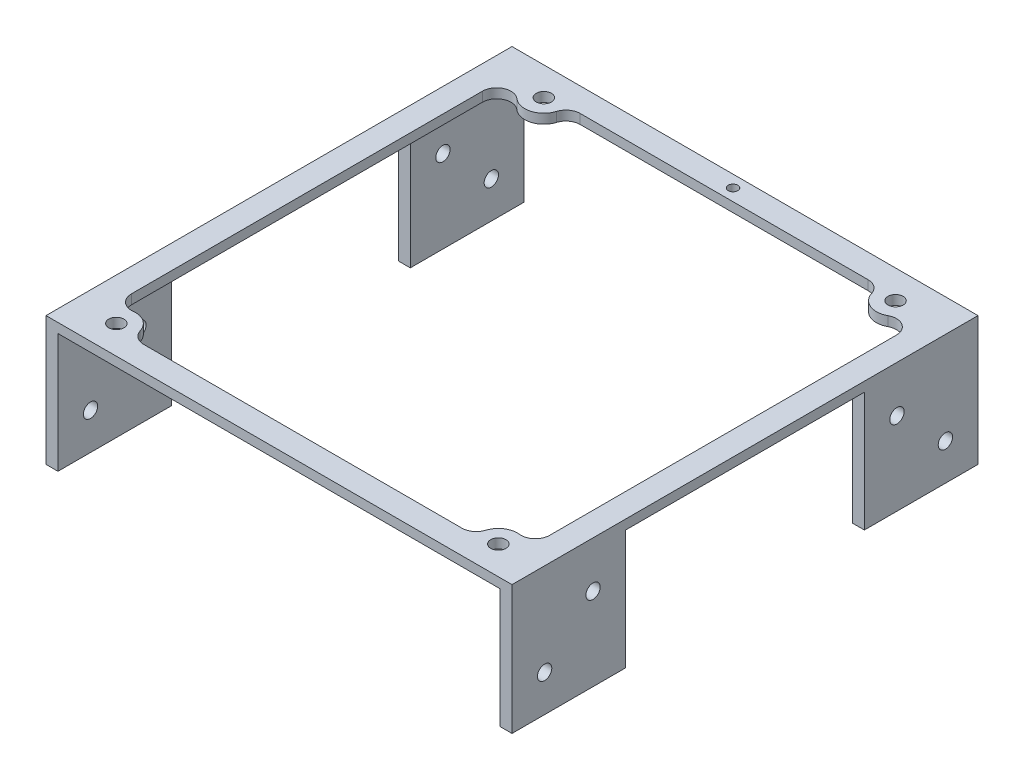
from build123d import *

# Parameters (mm, degrees)
SKETCH_1_W          = 97.6
SKETCH_1_H          = 97.6
SKETCH_1_R          = 1.59
EXTRUDE_1_DEPTH     = 2
SKETCH_2_R          = 1
CUT_EXTRUDE_1_DEPTH = 139.04173282
EXTRUDE_START       = -2
SKETCH_7_W          = 2.5
SKETCH_7_H          = 23.8
EXTRUDE_2_DEPTH     = 25
SKETCH_8_R          = 1.5
CUT_EXTRUDE_2_DEPTH = 141.273019501


with BuildPart() as part:
    # Эскиз1 → Бобышка-Вытянуть1 (new body)
    with BuildSketch(Plane(origin=(0, 0, 0), x_dir=(1, 0, 0), z_dir=(0, 1, 0))):
        with Locations((48.8, 48.8)):
            Rectangle(SKETCH_1_W, SKETCH_1_H)
        with Locations(Location((86.265001451, 91.665000306, 0), (0, 0, 270))):
            Circle(SKETCH_1_R, mode=Mode.SUBTRACT)
        with Locations(Location((88.805001451, 5.935000306, 0), (0, 0, 270))):
            Circle(SKETCH_1_R, mode=Mode.SUBTRACT)
        with Locations(Location((8.795001451, 5.935000306, 0), (0, 0, 270))):
            Circle(SKETCH_1_R, mode=Mode.SUBTRACT)
        with Locations(Location((12.605001451, 91.665000306, 0), (0, 0, 270))):
            Circle(SKETCH_1_R, mode=Mode.SUBTRACT)
        with BuildLine():
            Line((79.576520776, 92.6), (19.293482126, 92.6))
            ThreePointArc((19.293482126, 92.6), (17.512330868, 92.014021582), (16.426990408, 90.485000131))
            ThreePointArc((16.426990408, 90.485000131), (13.697675352, 87.817135476), (9.97357205, 88.652430089))
            ThreePointArc((9.97357205, 88.652430089), (6.759176917, 89.124368033), (5, 86.393002427))
            Line((5, 86.393002427), (5, 12.889708976))
            ThreePointArc((5, 12.889708976), (6.002770009, 10.651166513), (8.340714907, 9.909119546))
            ThreePointArc((8.340714907, 9.909119546), (10.982952752, 9.28356255), (12.616990516, 7.115000131))
            ThreePointArc((12.616990516, 7.115000131), (13.702330946, 5.5859785), (15.483482314, 5))
            Line((15.483482314, 5), (82.116520587, 5))
            ThreePointArc((82.116520587, 5), (83.897671955, 5.5859785), (84.983012386, 7.115000131))
            ThreePointArc((84.983012386, 7.115000131), (86.617049451, 9.283562094), (89.259286336, 9.909119736))
            ThreePointArc((89.259286336, 9.909119736), (91.597230458, 10.651167261), (92.6, 12.889709308))
            Line((92.6, 12.889709308), (92.6, 85.510507258))
            ThreePointArc((92.6, 85.510507258), (91.13495028, 88.088089), (88.170714907, 88.148147136))
            ThreePointArc((88.170714907, 88.148147136), (84.753959284, 87.961386993), (82.443012494, 90.485000131))
            ThreePointArc((82.443012494, 90.485000131), (81.357672034, 92.014021582), (79.576520776, 92.6))
        make_face(mode=Mode.SUBTRACT)
    extrude(amount=EXTRUDE_1_DEPTH)

    # Эскиз2 → Вырез-Вытянуть1 (cut, through all)
    with BuildSketch(Plane(origin=(0, 2, 0), x_dir=(1, 0, 0), z_dir=(0, 1, 0))):
        with Locations(Location((48.8, 95.1, 0), (0, 0, 270))):
            Circle(SKETCH_2_R)
    extrude(amount=-CUT_EXTRUDE_1_DEPTH, mode=Mode.SUBTRACT)

    # Эскиз7 → Бобышка-Вытянуть2 (add)
    with BuildSketch(Plane(origin=(0, 2, 0), x_dir=(1, 0, 0), z_dir=(0, 1, 0)).offset(EXTRUDE_START)):
        with Locations((1.25, 11.9)):
            Rectangle(SKETCH_7_W, SKETCH_7_H)
        with Locations((1.25, 85.7)):
            Rectangle(SKETCH_7_W, SKETCH_7_H)
        with Locations((96.35, 85.7)):
            Rectangle(SKETCH_7_W, SKETCH_7_H)
        with Locations((96.35, 11.9)):
            Rectangle(SKETCH_7_W, SKETCH_7_H)
    extrude(amount=-EXTRUDE_2_DEPTH)

    # Эскиз8 → Вырез-Вытянуть2 (cut, through all)
    with BuildSketch(Plane.ZY):
        with Locations((-80.630070031, -7.67342667)):
            Circle(SKETCH_8_R)
        with Locations(Location((-90.769929969, -17.32657333, 0), (0, 0, 180))):
            Circle(SKETCH_8_R)
        with Locations((-6.830070031, -17.32657333)):
            Circle(SKETCH_8_R)
        with Locations(Location((-16.969929969, -7.67342667, 0), (0, 0, 180))):
            Circle(SKETCH_8_R)
    extrude(amount=-CUT_EXTRUDE_2_DEPTH, mode=Mode.SUBTRACT)


solid = part.part
